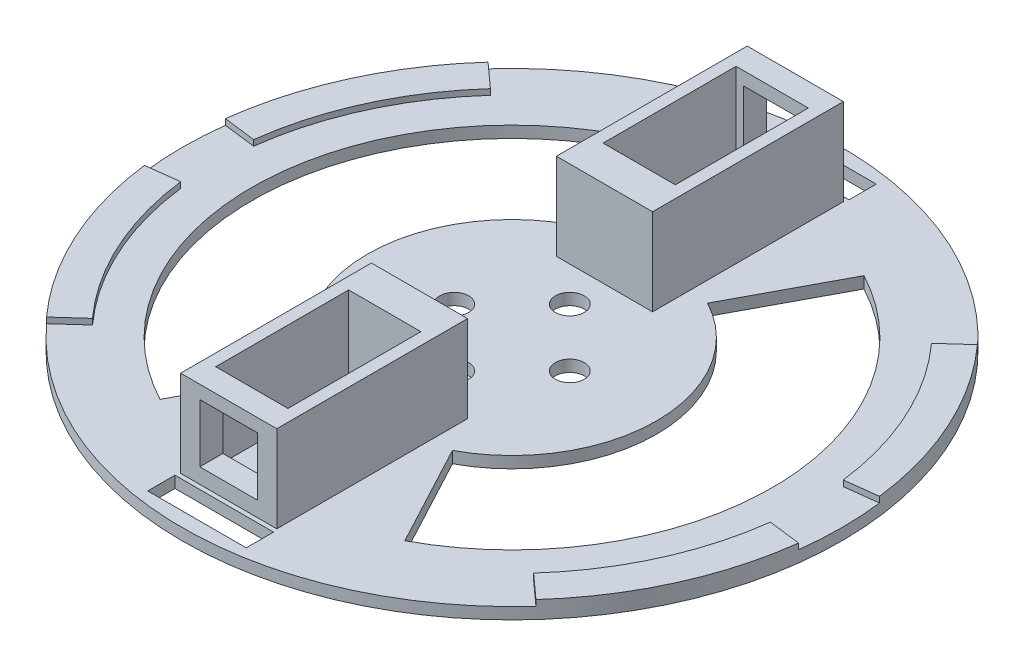
from build123d import *

# Parameters (mm, degrees)
SKETCH1_R           = 57
BOSS_EXTRUDE1_DEPTH = 2
BOSS_EXTRUDE2_DEPTH = 1
SKETCH3_W           = 16.631913854
SKETCH3_H           = 33
SKETCH3_W_2         = 12.5
SKETCH3_H_2         = 23
BOSS_EXTRUDE3_DEPTH = 15
SKETCH4_W           = 10
SKETCH4_H           = 10.084358196
CUT_EXTRUDE1_DEPTH  = 20
SKETCH5_W           = 17.04328316
SKETCH5_H           = 4.71779089
CUT_EXTRUDE2_DEPTH  = 20
SKETCH6_R           = 2.5
CUT_EXTRUDE3_DEPTH  = 20


with BuildPart() as part:
    # Sketch1 → Boss-Extrude1 (new body)
    with BuildSketch(Plane(origin=(0, 0, 0), x_dir=(1, 0, 0), z_dir=(0, 1, 0))):
        with Locations(Location((0, 0, 0), (0, 0, 270))):
            Circle(SKETCH1_R)
    extrude(amount=BOSS_EXTRUDE1_DEPTH)

    # Sketch2 → Boss-Extrude2 (add)
    with BuildSketch(Plane(origin=(0, 2, 0), x_dir=(1, 0, 0), z_dir=(0, 1, 0))):
        with BuildLine():
            Line((-56.568542495, 7), (-50.986982029, 6.30931713))
            ThreePointArc((-50.986982029, 6.30931713), (-46.729900776, 21.34938389), (-38.147214926, 34.413221478))
            Line((-38.147214926, 34.413221478), (-42.323202173, 38.180447324))
            ThreePointArc((-42.323202173, 38.180447324), (-51.84543726, 23.686507453), (-56.568542495, 7))
        make_face()
        with BuildLine():
            Line((42.323202173, 38.180447324), (38.147214926, 34.413221478))
            ThreePointArc((38.147214926, 34.413221478), (46.729900776, 21.34938389), (50.986982029, 6.30931713))
            Line((50.986982029, 6.30931713), (56.568542495, 7))
            ThreePointArc((56.568542495, 7), (51.84543726, 23.686507453), (42.323202173, 38.180447324))
        make_face()
        with BuildLine():
            Line((56.568542495, -7), (50.986982029, -6.30931713))
            ThreePointArc((50.986982029, -6.30931713), (46.729900776, -21.34938389), (38.147214926, -34.413221478))
            Line((38.147214926, -34.413221478), (42.323202173, -38.180447324))
            ThreePointArc((42.323202173, -38.180447324), (51.84543726, -23.686507453), (56.568542495, -7))
        make_face()
        with BuildLine():
            Line((-42.323202173, -38.180447324), (-38.147214926, -34.413221478))
            ThreePointArc((-38.147214926, -34.413221478), (-46.729900776, -21.34938389), (-50.986982029, -6.30931713))
            Line((-50.986982029, -6.30931713), (-56.568542495, -7))
            ThreePointArc((-56.568542495, -7), (-51.84543726, -23.686507453), (-42.323202173, -38.180447324))
        make_face()
    extrude(amount=BOSS_EXTRUDE2_DEPTH)

    # Sketch3 → Boss-Extrude3 (add)
    with BuildSketch(Plane(origin=(0, 2, 0), x_dir=(1, 0, 0), z_dir=(0, 1, 0))):
        with Locations((0, 32.5)):
            Rectangle(SKETCH3_W, SKETCH3_H)
        with Locations((0, 33.5)):
            Rectangle(SKETCH3_W_2, SKETCH3_H_2, mode=Mode.SUBTRACT)
    boss_extrude3 = extrude(amount=BOSS_EXTRUDE3_DEPTH)

    # Sketch4 → Cut-Extrude1 (cut)
    with BuildSketch(Plane(origin=(0, 0, -49), x_dir=(-1, 0, 0), z_dir=(0, 0, -1))):
        with Locations((0, 9.671309809)):
            Rectangle(SKETCH4_W, SKETCH4_H)
    cut_extrude1 = extrude(amount=-CUT_EXTRUDE1_DEPTH, mode=Mode.SUBTRACT)

    # Sketch5 → Cut-Extrude2 (cut)
    with BuildSketch(Plane(origin=(0, 2, 0), x_dir=(1, 0, 0), z_dir=(0, 1, 0))):
        with Locations((0, 52.127337333)):
            Rectangle(SKETCH5_W, SKETCH5_H)
    cut_extrude2 = extrude(amount=-CUT_EXTRUDE2_DEPTH, mode=Mode.SUBTRACT)

    # Mirror1: Boss-Extrude3, Cut-Extrude1, Cut-Extrude2 across plane
    add(boss_extrude3.mirror(Plane.XY))
    add(cut_extrude1.mirror(Plane.XY), mode=Mode.SUBTRACT)
    add(cut_extrude2.mirror(Plane.XY), mode=Mode.SUBTRACT)

    # Sketch6 → Cut-Extrude3 (cut)
    with BuildSketch(Plane(origin=(0, 2, 0), x_dir=(1, 0, 0), z_dir=(0, 1, 0))):
        with Locations(Location((-10, 0, 0), (0, 0, 270))):
            Circle(SKETCH6_R)
        with Locations(Location((0, 10, 0), (0, 0, 270))):
            Circle(SKETCH6_R)
        with Locations(Location((10, 0, 0), (0, 0, 270))):
            Circle(SKETCH6_R)
        with Locations(Location((0, -10, 0), (0, 0, 270))):
            Circle(SKETCH6_R)
        with BuildLine():
            Line((-21.172323644, 39.708093778), (-11.762402025, 22.060052099))
            ThreePointArc((-11.762402025, 22.060052099), (-25, 0), (-11.762402025, -22.060052099))
            Line((-11.762402025, -22.060052099), (-21.172323644, -39.708093778))
            ThreePointArc((-21.172323644, -39.708093778), (-45, 0), (-21.172323644, 39.708093778))
        make_face()
        with BuildLine():
            Line((21.172323644, 39.708093778), (11.762402025, 22.060052099))
            ThreePointArc((11.762402025, 22.060052099), (25, 0), (11.762402025, -22.060052099))
            Line((11.762402025, -22.060052099), (21.172323644, -39.708093778))
            ThreePointArc((21.172323644, -39.708093778), (45, 0), (21.172323644, 39.708093778))
        make_face()
    extrude(amount=-CUT_EXTRUDE3_DEPTH, mode=Mode.SUBTRACT)


solid = part.part
